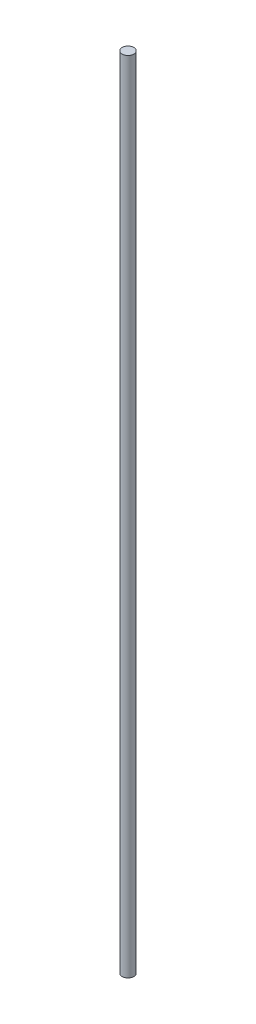
from build123d import *

# Parameters (mm, degrees)
SKETCH_1_R      = 4
EXTRUDE_1_DEPTH = 550


with BuildPart() as part:
    # 草图1 → 凸台-拉伸1 (new body)
    with BuildSketch(Plane(origin=(0, 0, 0), x_dir=(1, 0, 0), z_dir=(0, 1, 0))):
        with Locations(Location((0, 0, 0), (0, 0, 270))):
            Circle(SKETCH_1_R)
    extrude(amount=EXTRUDE_1_DEPTH)


solid = part.part
